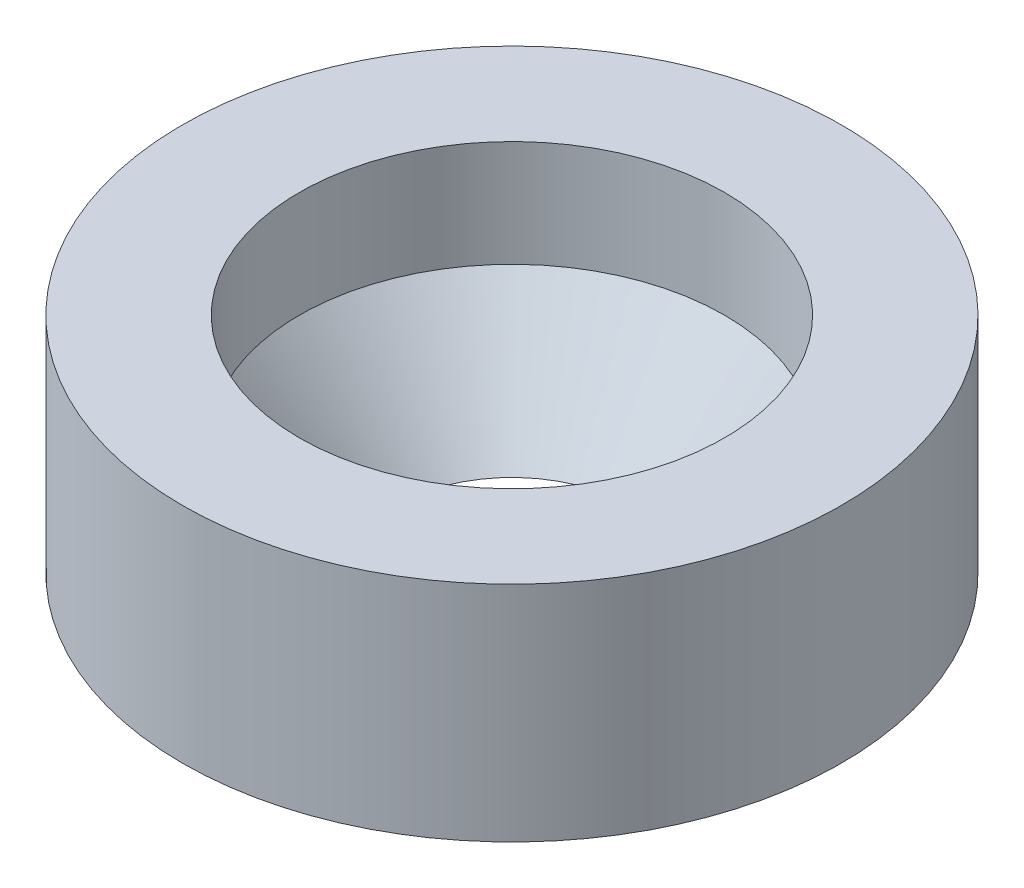
from build123d import *

# Parameters (mm, degrees)
SKETCH1_W = 2.2
SKETCH1_H = 2


with BuildPart() as part:
    # Sketch1 → Revolve1 (revolve)
    with BuildSketch(Plane(origin=(0, 0, 0), x_dir=(0, 0, -1), z_dir=(1, 0, 0)), mode=Mode.PRIVATE) as revolve1_sk:
        with Locations((5.1, 3.2)):
            Rectangle(SKETCH1_W, SKETCH1_H)
        Polygon((6.2, 2.2), (4, 2.2), (2.2, 0), (6.2, 0), align=None)
    revolve(revolve1_sk.sketch.rotate(Axis((0, 2.2, 0), (0, -1, 0)), 180), axis=Axis((0, 2.2, 0), (0, -1, 0)))


solid = part.part
